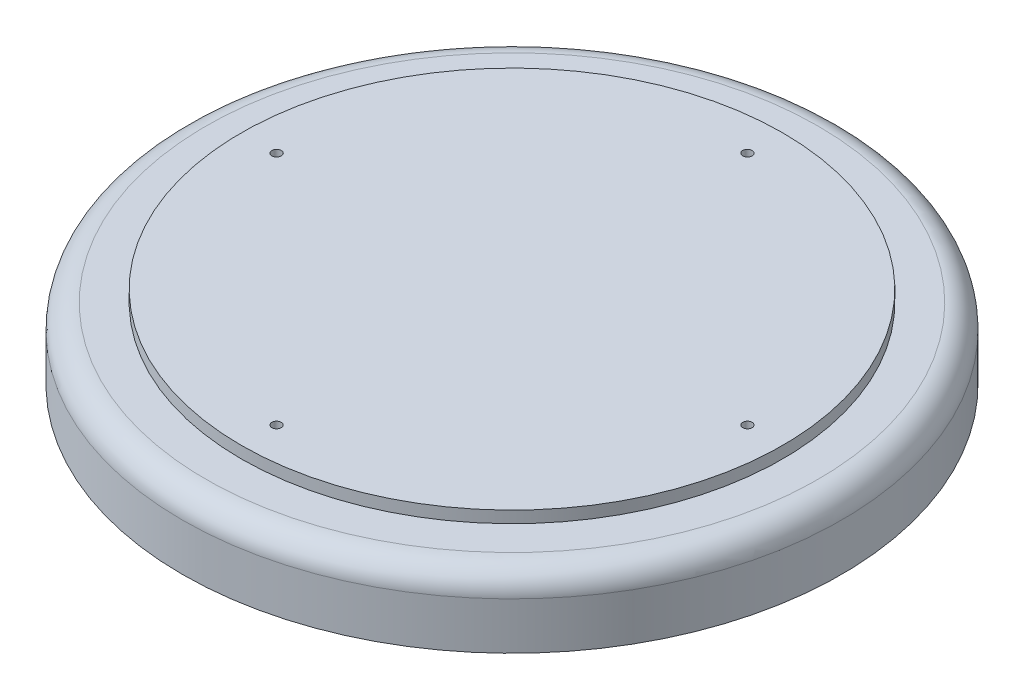
from build123d import *

# Parameters (mm, degrees)
SKETCH1_R           = 146.05
BOSS_EXTRUDE1_DEPTH = 6.35
SKETCH2_R           = 177.8
BOSS_EXTRUDE2_DEPTH = 38.1
SKETCH3_R           = 174.625
CUT_EXTRUDE2_DEPTH  = 34.925
FILLET2_R           = 12.7
FILLET3_R           = 12.7
SKETCH4_R           = 2.54
CUT_EXTRUDE3_DEPTH  = 9.525


with BuildPart() as part:
    # Sketch1 → Boss-Extrude1 (new body)
    with BuildSketch(Plane(origin=(0, 0, 0), x_dir=(1, 0, 0), z_dir=(0, 1, 0))):
        with Locations(Location((0, 0, 0), (0, 0, 270))):
            Circle(SKETCH1_R)
    extrude(amount=BOSS_EXTRUDE1_DEPTH)

    # Sketch2 → Boss-Extrude2 (add)
    with BuildSketch(Plane.XZ):
        with Locations(Location((0, 0, 0), (0, 0, 90))):
            Circle(SKETCH2_R)
    extrude(amount=BOSS_EXTRUDE2_DEPTH)

    # Sketch3 → Cut-Extrude2 (cut)
    with BuildSketch(Plane.XZ.offset(38.1)):
        with Locations(Location((0, 0, 0), (0, 0, 270))):
            Circle(SKETCH3_R)
    extrude(amount=-CUT_EXTRUDE2_DEPTH, mode=Mode.SUBTRACT)

    # Fillet2
    fillet2_edges = [part.edges().sort_by_distance(p)[0] for p in [
        (0, -3.175, 174.625),
    ]]
    fillet(fillet2_edges, radius=FILLET2_R)

    # Fillet3
    fillet3_edges = [part.edges().sort_by_distance(p)[0] for p in [
        (0, 0, -177.8),
    ]]
    fillet(fillet3_edges, radius=FILLET3_R)

    # Sketch4 → Cut-Extrude3 (cut)
    with BuildSketch(Plane(origin=(0, 6.35, 0), x_dir=(1, 0, 0), z_dir=(0, 1, 0))):
        with Locations(Location((0, 127, 0), (0, 0, 270))):
            Circle(SKETCH4_R)
        with Locations(Location((127, 0, 0), (0, 0, 270))):
            Circle(SKETCH4_R)
        with Locations(Location((-127, 0, 0), (0, 0, 270))):
            Circle(SKETCH4_R)
        with Locations(Location((0, -127, 0), (0, 0, 270))):
            Circle(SKETCH4_R)
    extrude(amount=-CUT_EXTRUDE3_DEPTH, mode=Mode.SUBTRACT)


solid = part.part
